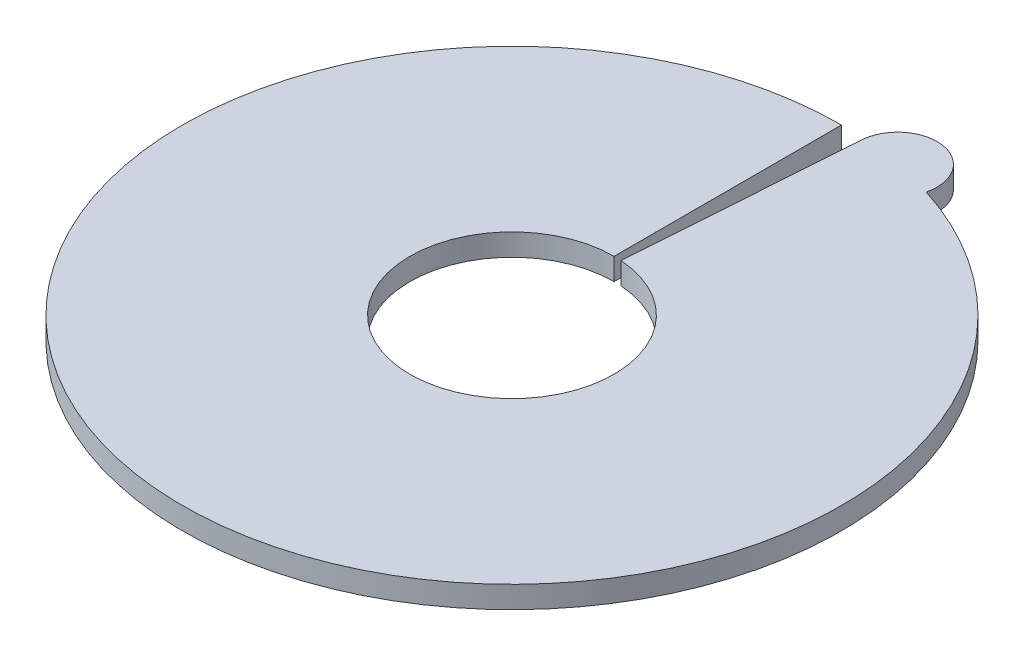
from build123d import *

# Parameters (mm, degrees)
BOSS_EXTRUDE2_DEPTH = 1


with BuildPart() as part:
    # Sketch1 → Boss-Extrude2 (new body)
    with BuildSketch(Plane(origin=(0, 0, 0), x_dir=(1, 0, 0), z_dir=(0, 1, 0))):
        with BuildLine():
            Line((0, 15), (0, 4.65))
            ThreePointArc((0, 4.65), (-0.163175848, -4.647136069), (0.326150697, 4.638547803))
            Line((0.326150697, 4.638547803), (1.052099022, 14.96305743))
            ThreePointArc((1.052099022, 14.96305743), (3.168172024, 16.491380461), (4.567296532, 14.287750081))
            ThreePointArc((4.567296532, 14.287750081), (-2.31124953, -14.82086791), (0, 15))
        make_face()
    extrude(amount=BOSS_EXTRUDE2_DEPTH)


solid = part.part
